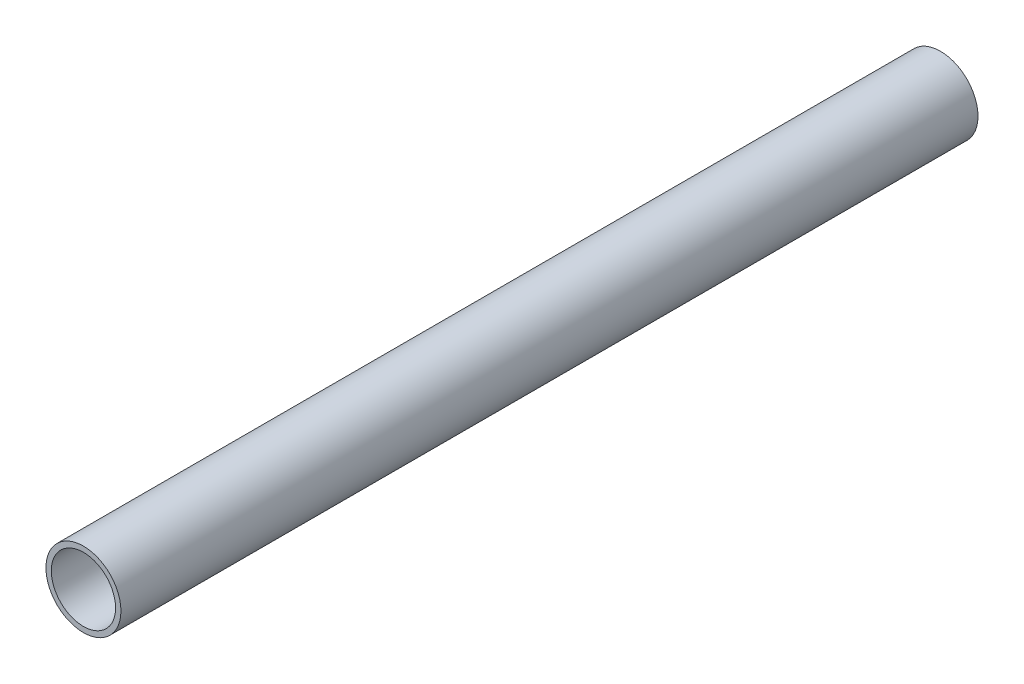
from build123d import *

# Parameters (mm, degrees)
SKETCH1_R           = 11.1125
SKETCH1_R_2         = 9.525
BOSS_EXTRUDE1_DEPTH = 127


with BuildPart() as part:
    # Sketch1 → Boss-Extrude1 (new, symmetric)
    with BuildSketch(Plane.XY):
        Circle(SKETCH1_R)
        Circle(SKETCH1_R_2, mode=Mode.SUBTRACT)
    extrude(amount=BOSS_EXTRUDE1_DEPTH, both=True)


solid = part.part
